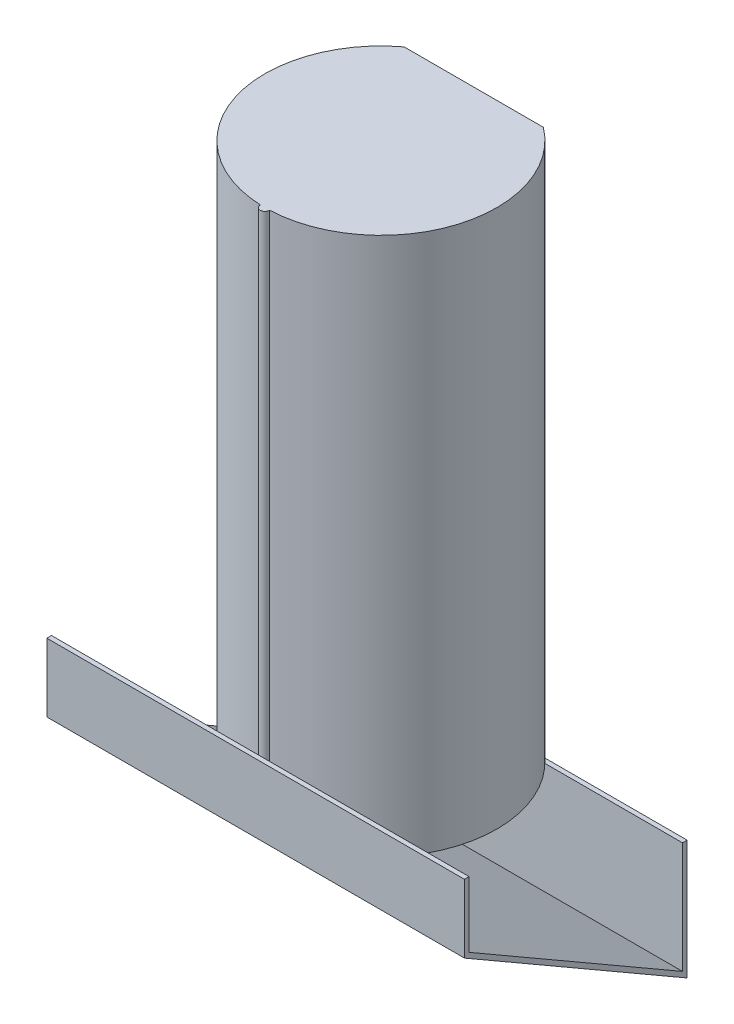
from build123d import *

# Parameters (mm, degrees)
EXTRUDE_1_DEPTH = 58
EXTRUDE_2_DEPTH = 22.5


with BuildPart() as part:
    # 草图1 → 凸台-拉伸1 (new body)
    with BuildSketch(Plane(origin=(0, 0, 0), x_dir=(1, 0, 0), z_dir=(0, 1, 0))):
        with BuildLine():
            Line((-7.5, 10), (7.5, 10))
            ThreePointArc((7.5, 10), (11.935226222, -3.714885602), (0.49989999, -12.49))
            ThreePointArc((0.49989999, -12.49), (0, -13), (-0.49989999, -12.49))
            ThreePointArc((-0.49989999, -12.49), (-11.935226222, -3.714885602), (-7.5, 10))
        make_face()
    extrude(amount=EXTRUDE_1_DEPTH)


with BuildPart() as body_2:
    # 草图2 → 凸台-拉伸2 (new, symmetric)
    with BuildSketch(Plane(origin=(0, 0, 0), x_dir=(0, 0, -1), z_dir=(1, 0, 0))):
        Polygon((-13, 0), (10, -13.279056191), (10, -1.279056191), (10.5, -1.279056191), (10.5, -14.145081595), (-13.5, -0.288675135), (-13.5, 7.068703683), (-13, 7.068703683), align=None)
    extrude(amount=EXTRUDE_2_DEPTH, both=True)


solid = Compound([part.part, body_2.part])
